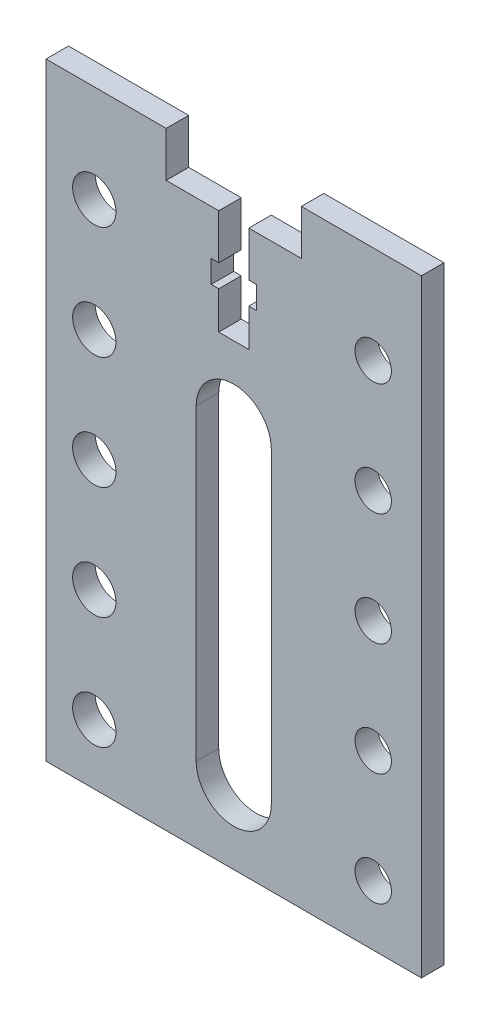
from build123d import *

# Parameters (mm, degrees)
ESQUISSE1_W             = 50
ESQUISSE1_H             = 81
BOSS_EXTRU_1_DEPTH      = 3
ESQUISSE2_W             = 18
ESQUISSE2_H             = 6
ENL_V_MAT_EXTRU_1_DEPTH = 3
ENL_V_MAT_EXTRU_2_DEPTH = 3
ESQUISSE5_R             = 2.885610726
ESQUISSE5_R_2           = 2.423229835
ENL_V_MAT_EXTRU_3_DEPTH = 3


with BuildPart() as part:
    # Esquisse1 → Boss.-Extru.1 (new body)
    with BuildSketch(Plane.XY):
        with Locations((-16.166294243, 13.176556017)):
            Rectangle(ESQUISSE1_W, ESQUISSE1_H)
    extrude(amount=BOSS_EXTRU_1_DEPTH)

    # Esquisse2 → Enlèv. mat.-Extru.1 (cut)
    with BuildSketch(Plane.XY.offset(3)):
        with Locations((-16.166294243, 50.676556017)):
            Rectangle(ESQUISSE2_W, ESQUISSE2_H)
    extrude(amount=-ENL_V_MAT_EXTRU_1_DEPTH, mode=Mode.SUBTRACT)

    # Esquisse3 → Enlèv. mat.-Extru.2 (cut)
    with BuildSketch(Plane.XY.offset(3)):
        Polygon((-18.166294243, 41.676556017), (-19.166294243, 41.676556017), (-19.166294243, 38.676556017), (-18.166294243, 38.676556017), (-18.166294243, 33.676556017), (-14.166294243, 33.676556017), (-14.166294243, 38.676556017), (-13.166294243, 38.676556017), (-13.166294243, 41.676556017), (-14.166294243, 41.676556017), (-14.166294243, 47.676556017), (-18.166294243, 47.676556017), align=None)
        with BuildLine():
            Line((-11.166294243, 23.676556017), (-11.166294243, -17.323443983))
            ThreePointArc((-11.166294243, -17.323443983), (-16.166294243, -22.323443983), (-21.166294243, -17.323443983))
            Line((-21.166294243, -17.323443983), (-21.166294243, 23.676556017))
            ThreePointArc((-21.166294243, 23.676556017), (-16.166294243, 28.676556017), (-11.166294243, 23.676556017))
        make_face()
    extrude(amount=-ENL_V_MAT_EXTRU_2_DEPTH, mode=Mode.SUBTRACT)

    # Esquisse5 → Enlèv. mat.-Extru.3 (cut)
    with BuildSketch(Plane.XY.offset(3)):
        with Locations((-34.741294243, -19.323443983)):
            Circle(ESQUISSE5_R)
        with Locations((2.408705757, -19.323443983)):
            Circle(ESQUISSE5_R_2)
        with Locations((-34.741294243, -4.323443983)):
            Circle(ESQUISSE5_R)
        with Locations((2.408705757, -4.323443983)):
            Circle(ESQUISSE5_R_2)
        with Locations((-34.741294243, 10.676556017)):
            Circle(ESQUISSE5_R)
        with Locations((2.408705757, 10.676556017)):
            Circle(ESQUISSE5_R_2)
        with Locations((-34.741294243, 25.676556017)):
            Circle(ESQUISSE5_R)
        with Locations((2.408705757, 25.676556017)):
            Circle(ESQUISSE5_R_2)
        with Locations((-34.741294243, 40.676556017)):
            Circle(ESQUISSE5_R)
        with Locations((2.408705757, 40.676556017)):
            Circle(ESQUISSE5_R_2)
    extrude(amount=-ENL_V_MAT_EXTRU_3_DEPTH, mode=Mode.SUBTRACT)


solid = part.part
